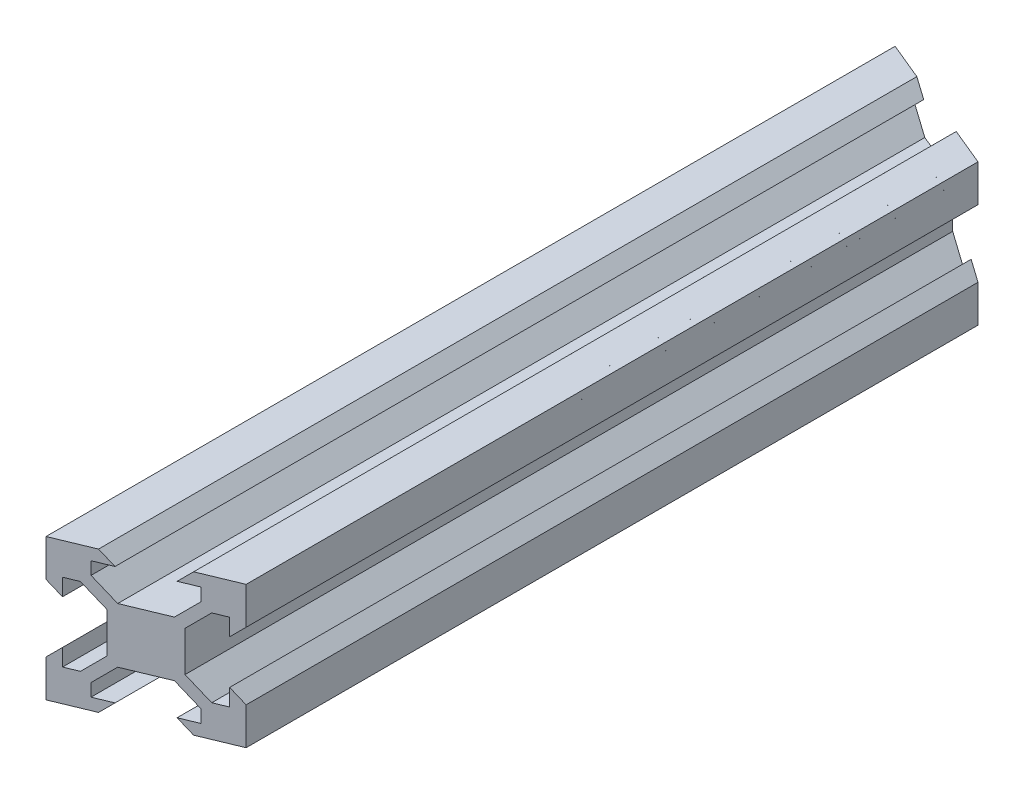
from build123d import *

# Parameters (mm, degrees)
BOSS_EXTRUDE1_DEPTH = 120
CUT_EXTRUDE1_DEPTH  = 123.065088938
CUT_EXTRUDE2_DEPTH  = 123.065088938


with BuildPart() as part:
    # Sketch1 → Boss-Extrude1 (new body)
    with BuildSketch(Plane.XY):
        Polygon((-2.834320347, 3.893970342), (2.834320347, 3.893970342), (5.5, 6.558849663), (5.5, 8.349069506), (3.1, 8.349069506), (4.75, 9.998574117), (10, 9.998574117), (10, 4.746997406), (8.35, 3.097492795), (8.350720674, 5.497492687), (6.560500912, 5.498030255), (3.894821259, 2.833150935), (3.894821259, -2.833150935), (6.560500912, -5.498030255), (8.350720674, -5.497492687), (8.35, -3.097492795), (10, -4.746997406), (10, -9.998574117), (4.75, -9.998574117), (3.1, -8.349069506), (5.5, -8.349069506), (5.5, -6.558849663), (2.834320347, -3.893970342), (-2.834320347, -3.893970342), (-5.5, -6.558849663), (-5.5, -8.349069506), (-3.1, -8.349069506), (-4.75, -9.998574117), (-10, -9.998574117), (-10, -4.746997406), (-8.35, -3.097492795), (-8.350720674, -5.497492687), (-6.560500912, -5.498030255), (-3.894821259, -2.833150935), (-3.894821259, 2.833150935), (-6.560500912, 5.498030255), (-8.350720674, 5.497492687), (-8.35, 3.097492795), (-10, 4.746997406), (-10, 9.998574117), (-4.75, 9.998574117), (-3.1, 8.349069506), (-5.5, 8.349069506), (-5.5, 6.558849663), align=None)
    extrude(amount=BOSS_EXTRUDE1_DEPTH)

    # Sketch2 → Cut-Extrude1 (cut, through all)
    with BuildSketch(Plane(origin=(0, 9.998574117, 0), x_dir=(1, 0, 0), z_dir=(0, 1, 0))):
        Polygon((-10, -120), (10, -111.715728753), (10, -120), align=None)
    extrude(amount=-CUT_EXTRUDE1_DEPTH, mode=Mode.SUBTRACT)

    # Sketch3 → Cut-Extrude2 (cut, through all)
    with BuildSketch(Plane(origin=(0, 9.998574117, 0), x_dir=(1, 0, 0), z_dir=(0, 1, 0))):
        Polygon((-10, 0), (10, -8.284271247), (10, 0), align=None)
    extrude(amount=-CUT_EXTRUDE2_DEPTH, mode=Mode.SUBTRACT)


solid = part.part
